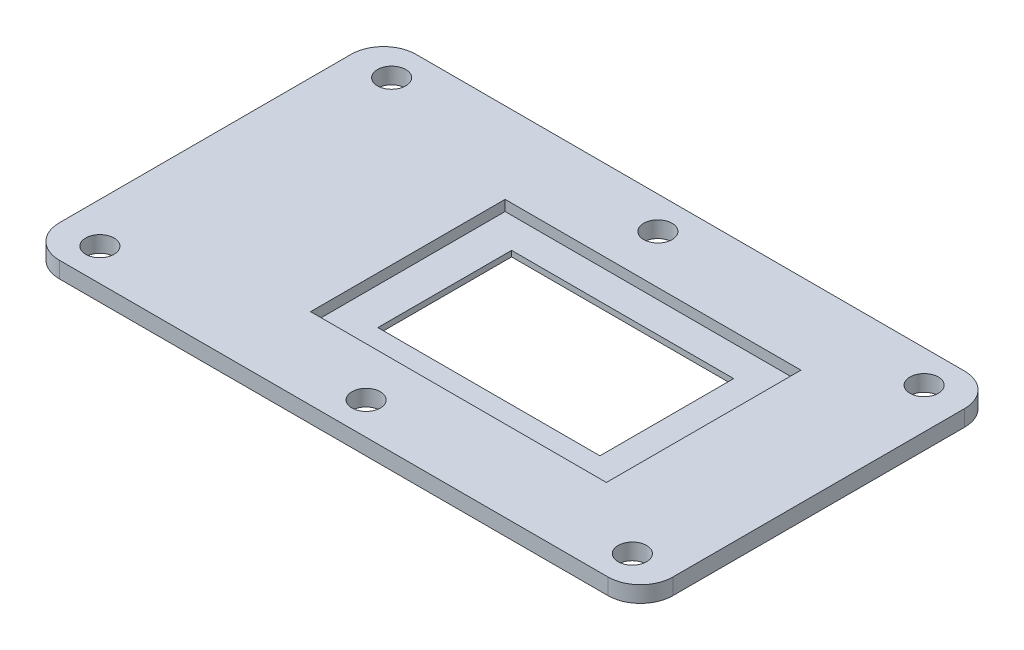
from build123d import *

# Parameters (mm, degrees)
SKETCH1_W           = 36.5
SKETCH1_H           = 24
SKETCH1_R           = 1.75
BOSS_EXTRUDE1_DEPTH = 2
SKETCH1_3_W         = 36.5
SKETCH1_3_H         = 24
SKETCH1_3_W_2       = 27.4
SKETCH1_3_H_2       = 16.5
BOSS_EXTRUDE2_DEPTH = 0.7


with BuildPart() as part:
    # Sketch1 → Boss-Extrude1 (new body)
    with BuildSketch(Plane(origin=(0, 0, 0), x_dir=(1, 0, 0), z_dir=(0, 1, 0))):
        with BuildLine():
            Line((28.45, 22), (-39.25, 22))
            ThreePointArc((-39.25, 22), (-42.078427125, 20.828427125), (-43.25, 18))
            Line((-43.25, 18), (-43.25, -18))
            ThreePointArc((-43.25, -18), (-42.078427125, -20.828427125), (-39.25, -22))
            Line((-39.25, -22), (28.45, -22))
            ThreePointArc((28.45, -22), (31.278427125, -20.828427125), (32.45, -18))
            Line((32.45, -18), (32.45, 18))
            ThreePointArc((32.45, 18), (31.278427125, 20.828427125), (28.45, 22))
        make_face()
        Rectangle(SKETCH1_W, SKETCH1_H, mode=Mode.SUBTRACT)
        with Locations((-38.25, -18)):
            Circle(SKETCH1_R, mode=Mode.SUBTRACT)
        with Locations((-5.4, -18)):
            Circle(SKETCH1_R, mode=Mode.SUBTRACT)
        with Locations((27.45, -18)):
            Circle(SKETCH1_R, mode=Mode.SUBTRACT)
        with Locations((27.45, 18)):
            Circle(SKETCH1_R, mode=Mode.SUBTRACT)
        with Locations((-38.25, 18)):
            Circle(SKETCH1_R, mode=Mode.SUBTRACT)
        with Locations((-5.4, 18)):
            Circle(SKETCH1_R, mode=Mode.SUBTRACT)
    extrude(amount=BOSS_EXTRUDE1_DEPTH)

    # Sketch1<3> → Boss-Extrude2 (add)
    with BuildSketch(Plane(origin=(0, 0, 0), x_dir=(1, 0, 0), z_dir=(0, 1, 0))):
        Rectangle(SKETCH1_3_W, SKETCH1_3_H)
        Rectangle(SKETCH1_3_W_2, SKETCH1_3_H_2, mode=Mode.SUBTRACT)
    extrude(amount=BOSS_EXTRUDE2_DEPTH)


solid = part.part
